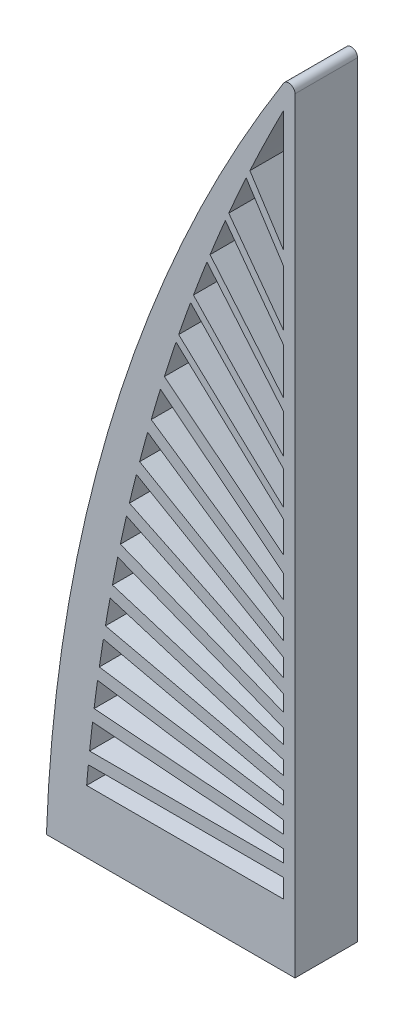
from build123d import *

# Parameters (mm, degrees)
BOSS_EXTRUDE4_DEPTH = 10
BOSS_EXTRUDE5_DEPTH = 10


with BuildPart() as part:
    # Sketch5 → Boss-Extrude4 (new body)
    with BuildSketch(Plane.XY):
        with BuildLine():
            Line((0, 0), (0, 122.364670388))
            ThreePointArc((0, 122.364670388), (-0.722776757, 123.325475922), (-1.846294547, 122.89738564))
            ThreePointArc((-1.846294547, 122.89738564), (-28.906490201, 63.952063235), (-39.720316086, 0))
            Line((-39.720316086, 0), (0, 0))
        make_face()
        with BuildLine():
            Line((-1.8, 10), (-33.298, 10))
            ThreePointArc((-33.298, 10), (-22.875707389, 66.135343677), (-1.8, 119.197717832))
            Line((-1.8, 119.197717832), (-1.8, 10))
        make_face(mode=Mode.SUBTRACT)
    extrude(amount=BOSS_EXTRUDE4_DEPTH)

    # Sketch8 → Boss-Extrude5 (add)
    with BuildSketch(Plane.XY):
        with BuildLine():
            Line((-33.02290127, 13), (-1.8, 13))
            Line((-1.8, 13), (-1.8, 15))
            Line((-1.8, 15), (-32.822260718, 15))
            ThreePointArc((-32.822260718, 15), (-32.924290216, 14.00017147), (-33.02290127, 13))
        make_face()
        with BuildLine():
            Line((-31.551287828, 25.428873475), (-1.8, 20.944756944))
            Line((-1.8, 20.944756944), (-1.8, 22.967345922))
            Line((-1.8, 22.967345922), (-31.267160482, 27.408638756))
            ThreePointArc((-31.267160482, 27.408638756), (-31.410907676, 26.418997727), (-31.551287828, 25.428873475))
        make_face()
        with BuildLine():
            Line((-32.351201095, 19.239482352), (-1.8, 16.950071453))
            Line((-1.8, 16.950071453), (-1.8, 18.955679124))
            Line((-1.8, 18.955679124), (-32.108897466, 21.226932551))
            ThreePointArc((-32.108897466, 21.226932551), (-32.231741124, 20.233413716), (-32.351201095, 19.239482352))
        make_face()
        with BuildLine():
            Line((-30.618838123, 31.608168854), (-1.8, 25.030709106))
            Line((-1.8, 25.030709106), (-1.8, 27.082138941))
            Line((-1.8, 27.082138941), (-30.292091958, 33.585023866))
            ThreePointArc((-30.292091958, 33.585023866), (-30.457149134, 32.596874717), (-30.618838123, 31.608168854))
        make_face()
        with BuildLine():
            Line((-29.545931615, 37.81700869), (-1.8, 29.258858956))
            Line((-1.8, 29.258858956), (-1.8, 31.351837274))
            Line((-1.8, 31.351837274), (-29.175137635, 39.795616712))
            ThreePointArc((-29.175137635, 39.795616712), (-29.3622281, 38.806630061), (-29.545931615, 37.81700869))
        make_face()
        with BuildLine():
            Line((-28.320844309, 44.095333315), (-1.8, 33.687092884))
            Line((-1.8, 33.687092884), (-1.8, 35.835600273))
            Line((-1.8, 35.835600273), (-27.903926427, 46.080219158))
            ThreePointArc((-27.903926427, 46.080219158), (-28.114096999, 45.088135758), (-28.320844309, 44.095333315))
        make_face()
        with BuildLine():
            Line((-26.927669735, 50.484015361), (-1.8, 38.383681924))
            Line((-1.8, 38.383681924), (-1.8, 40.603496684))
            Line((-1.8, 40.603496684), (-26.461878817, 52.479526575))
            ThreePointArc((-26.461878817, 52.479526575), (-26.696512847, 51.482176784), (-26.927669735, 50.484015361))
        make_face()
        with BuildLine():
            Line((-25.34575305, 57.025462495), (-1.8, 43.431924442))
            Line((-1.8, 43.431924442), (-1.8, 45.741299663))
            Line((-1.8, 45.741299663), (-24.827629625, 59.035712413))
            ThreePointArc((-24.827629625, 59.035712413), (-25.088465651, 58.031044767), (-25.34575305, 57.025462495))
        make_face()
        with BuildLine():
            Line((-23.548915199, 63.764175049), (-1.8, 48.936721808))
            Line((-1.8, 48.936721808), (-1.8, 51.357293007))
            Line((-1.8, 51.357293007), (-22.974243013, 65.792960042))
            ThreePointArc((-22.974243013, 65.792960042), (-23.26339795, 64.77908275), (-23.548915199, 63.764175049))
        make_face()
        with BuildLine():
            Line((-21.504437213, 70.747227787), (-1.8, 55.034267194))
            Line((-1.8, 55.034267194), (-1.8, 57.592312347))
            Line((-1.8, 57.592312347), (-20.868191149, 72.797909588))
            ThreePointArc((-20.868191149, 72.797909588), (-21.188186233, 71.773149512), (-21.504437213, 70.747227787))
        make_face()
        with BuildLine():
            Line((-19.009701273, 78.507124213), (-1.8, 62.539493808))
            Line((-1.8, 62.539493808), (-1.8, 64.176455444))
            Line((-1.8, 64.176455444), (-18.587222465, 79.752098484))
            ThreePointArc((-18.587222465, 79.752098484), (-18.799157777, 79.129847503), (-19.009701273, 78.507124213))
        make_face()
        with BuildLine():
            Line((-16.685267787, 85.144051641), (-1.8, 69.502691427))
            Line((-1.8, 69.502691427), (-1.8, 71.243382102))
            Line((-1.8, 71.243382102), (-16.22487287, 86.400961786))
            ThreePointArc((-16.22487287, 86.400961786), (-16.455785666, 85.772768735), (-16.685267787, 85.144051641))
        make_face()
        with BuildLine():
            Line((-14.072204317, 92.056761761), (-1.8, 77.440823569))
            Line((-1.8, 77.440823569), (-1.8, 79.306980252))
            Line((-1.8, 79.306980252), (-13.570797112, 93.325752969))
            ThreePointArc((-13.570797112, 93.325752969), (-13.822236892, 92.691548245), (-14.072204317, 92.056761761))
        make_face()
        with BuildLine():
            Line((-11.127713878, 99.276715969), (-1.8, 86.650543681))
            Line((-1.8, 86.650543681), (-1.8, 88.670070899))
            Line((-1.8, 88.670070899), (-10.581907863, 100.557429702))
            ThreePointArc((-10.581907863, 100.557429702), (-10.855568937, 99.917395903), (-11.127713878, 99.276715969))
        make_face()
        with BuildLine():
            Line((-7.801640698, 106.835271915), (-1.8, 97.555550659))
            Line((-1.8, 97.555550659), (-1.8, 99.765221681))
            Line((-1.8, 99.765221681), (-7.207784689, 108.126724319))
            ThreePointArc((-7.207784689, 108.126724319), (-7.505493193, 107.481357019), (-7.801640698, 106.835271915))
        make_face()
    extrude(amount=BOSS_EXTRUDE5_DEPTH)


solid = part.part
